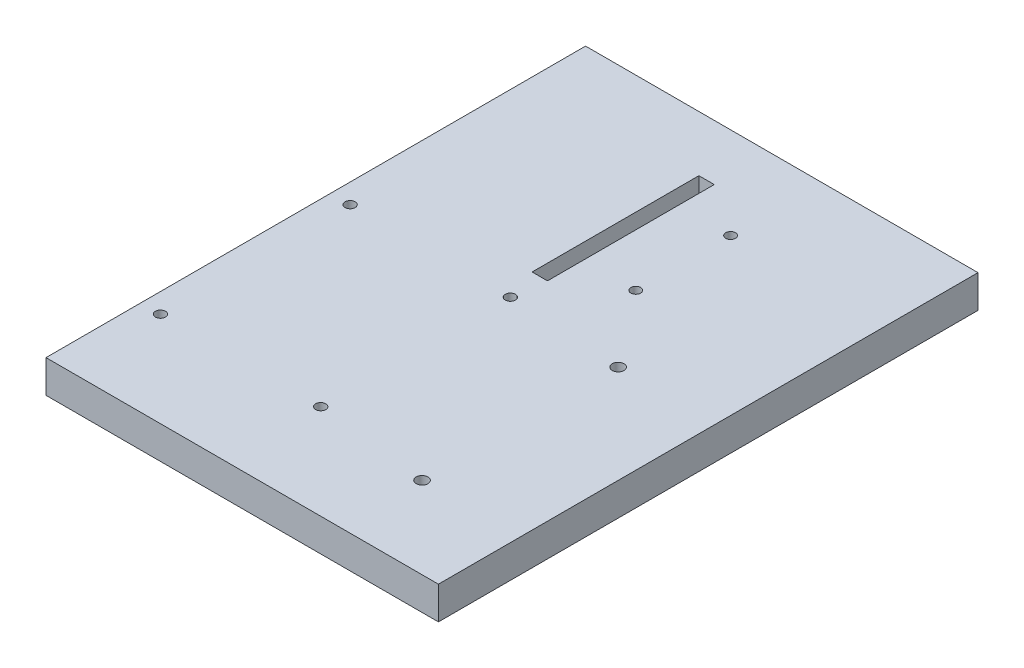
from build123d import *

# Parameters (mm, degrees)
SKETCH1_W                     = 120
SKETCH1_H                     = 165
BASE_DEPTH                    = 10
PI_MOUNTHOLES_AT_2_COUNT      = 2
PI_MOUNTHOLES_AT_2_PITCH      = 49
PI_MOUNTHOLES_AT_3_COUNT      = 2
PI_MOUNTHOLES_AT_3_PITCH      = 75.927597091
PI_MOUNTHOLES_AT_4_COUNT      = 2
PI_MOUNTHOLES_AT_4_PITCH      = 58
BATTERY_MOUNTHOLES_AT_2_COUNT = 2
BATTERY_MOUNTHOLES_AT_2_PITCH = 59.95
SKETCH17_W                    = 4.7
SKETCH17_H                    = 51
STEPPERBRACKETSLOT_DEPTH      = 10
SKETCH18_R                    = 1.5
ANGLEBRACKET_MOUNTHOLES_DEPTH = 10


with BuildPart() as part:
    # Sketch1 → Base (new body)
    with BuildSketch(Plane(origin=(0, 0, 0), x_dir=(1, 0, 0), z_dir=(0, 1, 0))):
        with Locations((60, 82.5)):
            Rectangle(SKETCH1_W, SKETCH1_H)
    extrude(amount=BASE_DEPTH)

    # Sketch14 → Pi-MountHoles (revolve, cut)
    with BuildSketch(Plane(origin=(6, 0, -29), x_dir=(0, 0, -1), z_dir=(1, 0, 0))):
        Polygon((0, 0), (0, 10), (1.55, 10), (1.55, 2.1), (3, 2.1), (3, 0.025), (3.025, 0), align=None)
    pi_mountholes = revolve(axis=Axis((6, -6.35, -29), (0, 1, 0)), mode=Mode.SUBTRACT)

    # Pi-MountHoles at 2: Pi-MountHoles ×2
    with Locations(*[(i * PI_MOUNTHOLES_AT_2_PITCH, 0, 0) for i in range(1, PI_MOUNTHOLES_AT_2_COUNT)]):
        add(pi_mountholes, mode=Mode.SUBTRACT)

    # Pi-MountHoles at 3: Pi-MountHoles ×2
    with Locations(*[Vector(0.6453516491682099, 0, -0.7638856255460447) * (i * PI_MOUNTHOLES_AT_3_PITCH) for i in range(1, PI_MOUNTHOLES_AT_3_COUNT)]):
        add(pi_mountholes, mode=Mode.SUBTRACT)

    # Pi-MountHoles at 4: Pi-MountHoles ×2
    with Locations(*[(0, 0, -i * PI_MOUNTHOLES_AT_4_PITCH) for i in range(1, PI_MOUNTHOLES_AT_4_COUNT)]):
        add(pi_mountholes, mode=Mode.SUBTRACT)

    # Sketch16 → Battery-MountHoles (revolve, cut)
    with BuildSketch(Plane(origin=(90, 0, -25), x_dir=(0, 0, -1), z_dir=(1, 0, 0))):
        Polygon((0, 0), (0, 10), (1.8, 10), (1.8, 2.4), (3.5, 2.4), (3.5, 0.025), (3.525, 0), align=None)
    battery_mountholes = revolve(axis=Axis((90, -6.35, -25), (0, 1, 0)), mode=Mode.SUBTRACT)

    # Battery-MountHoles at 2: Battery-MountHoles ×2
    with Locations(*[(0, 0, -i * BATTERY_MOUNTHOLES_AT_2_PITCH) for i in range(1, BATTERY_MOUNTHOLES_AT_2_COUNT)]):
        add(battery_mountholes, mode=Mode.SUBTRACT)

    # Sketch17 → StepperBracketSlot (cut)
    with BuildSketch(Plane(origin=(0, 10, 0), x_dir=(1, 0, 0), z_dir=(0, 1, 0))):
        with Locations((54, 122.5)):
            Rectangle(SKETCH17_W, SKETCH17_H)
    extrude(amount=-STEPPERBRACKETSLOT_DEPTH, mode=Mode.SUBTRACT)

    # Sketch18 → AngleBracket-MountHoles (cut)
    with BuildSketch(Plane(origin=(0, 10, 0), x_dir=(1, 0, 0), z_dir=(0, 1, 0))):
        with Locations(Location((72.35, 137, 0), (0, 0, 270))):
            Circle(SKETCH18_R)
        with Locations(Location((72.35, 108, 0), (0, 0, 270))):
            Circle(SKETCH18_R)
    extrude(amount=-ANGLEBRACKET_MOUNTHOLES_DEPTH, mode=Mode.SUBTRACT)


solid = part.part
